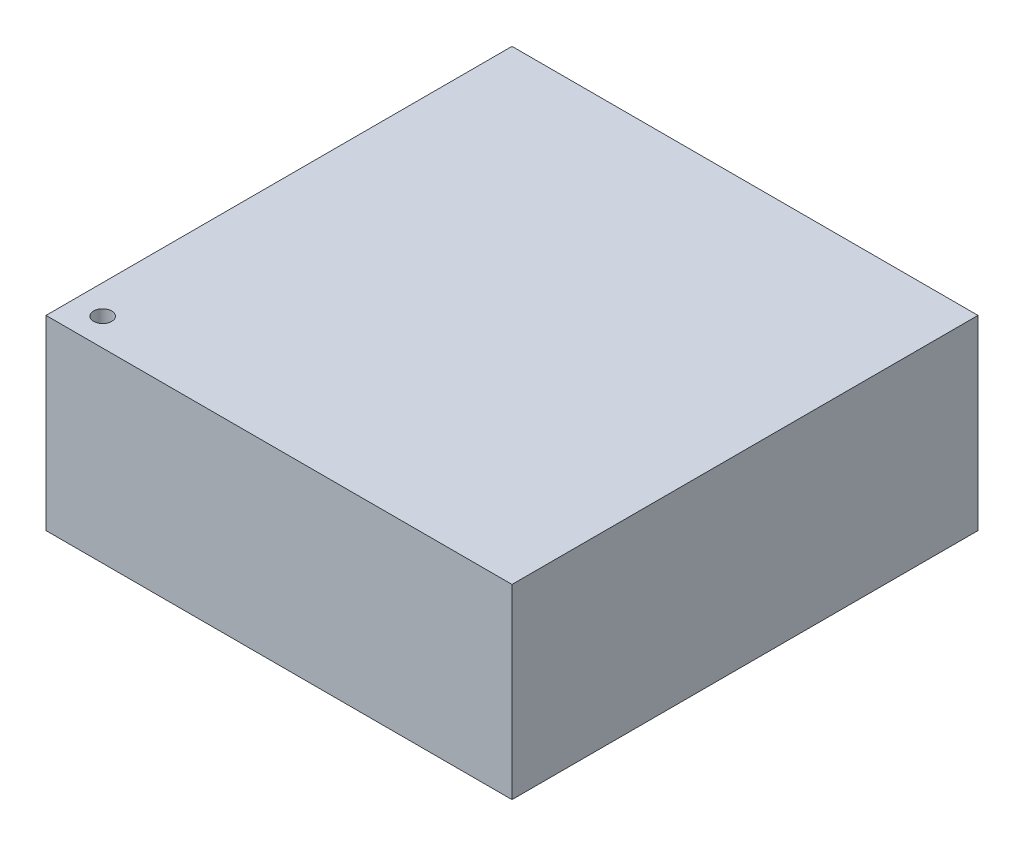
from build123d import *

# Parameters (mm, degrees)
SKETCH1_W           = 130
SKETCH1_H           = 130
BOSS_EXTRUDE1_DEPTH = 52
SKETCH2_R           = 2.527235636
CUT_EXTRUDE1_DEPTH  = 10


with BuildPart() as part:
    # Sketch1 → Boss-Extrude1 (new body)
    with BuildSketch(Plane(origin=(0, 0, 0), x_dir=(1, 0, 0), z_dir=(0, 1, 0))):
        Rectangle(SKETCH1_W, SKETCH1_H)
    extrude(amount=BOSS_EXTRUDE1_DEPTH)

    # Sketch2 → Cut-Extrude1 (cut)
    with BuildSketch(Plane(origin=(0, 52, 0), x_dir=(1, 0, 0), z_dir=(0, 1, 0))):
        with Locations(Location((-56.907861824, -57.290089516, 0), (0, 0, 270))):
            Circle(SKETCH2_R)
    extrude(amount=-CUT_EXTRUDE1_DEPTH, mode=Mode.SUBTRACT)


solid = part.part
